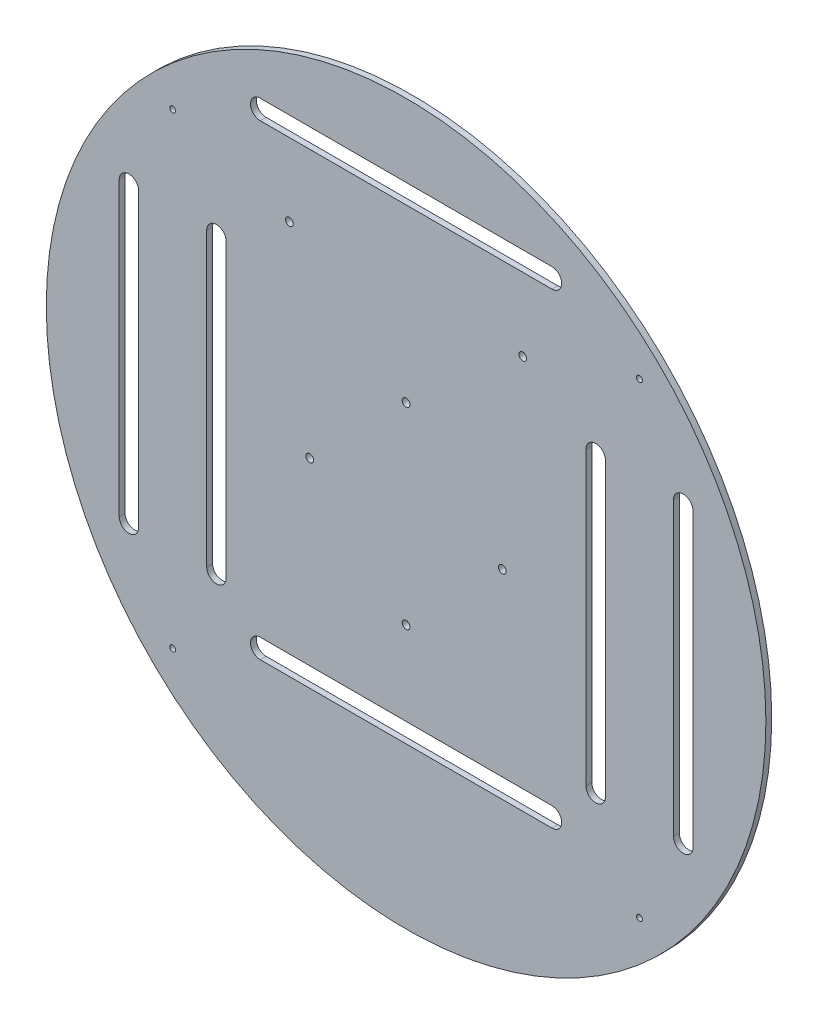
from build123d import *

# Parameters (mm, degrees)
SKETCH_1_R          = 185
SKETCH_1_R_2        = 1.5
EXTRUDE_1_DEPTH     = 3
SKETCH_2_R          = 2
CUT_EXTRUDE_1_DEPTH = 10


with BuildPart() as part:
    # 草图1 → 凸台-拉伸1 (new body)
    with BuildSketch(Plane.XY):
        Circle(SKETCH_1_R)
        with Locations((-120, 120)):
            Circle(SKETCH_1_R_2, mode=Mode.SUBTRACT)
        with Locations((120, 120)):
            Circle(SKETCH_1_R_2, mode=Mode.SUBTRACT)
        with Locations((120, -120)):
            Circle(SKETCH_1_R_2, mode=Mode.SUBTRACT)
        with Locations((-120, -120)):
            Circle(SKETCH_1_R_2, mode=Mode.SUBTRACT)
        with BuildLine():
            Line((-102.5, -75), (-102.5, 75))
            ThreePointArc((-102.5, 75), (-97.5, 80), (-92.5, 75))
            Line((-92.5, 75), (-92.5, -75))
            ThreePointArc((-92.5, -75), (-97.5, -80), (-102.5, -75))
        make_face(mode=Mode.SUBTRACT)
        with BuildLine():
            Line((147.5, -75), (147.5, 75))
            ThreePointArc((147.5, 75), (142.5, 80), (137.5, 75))
            Line((137.5, 75), (137.5, -75))
            ThreePointArc((137.5, -75), (142.5, -80), (147.5, -75))
        make_face(mode=Mode.SUBTRACT)
        with BuildLine():
            Line((-147.5, -75), (-147.5, 75))
            ThreePointArc((-147.5, 75), (-142.5, 80), (-137.5, 75))
            Line((-137.5, 75), (-137.5, -75))
            ThreePointArc((-137.5, -75), (-142.5, -80), (-147.5, -75))
        make_face(mode=Mode.SUBTRACT)
        with BuildLine():
            Line((-75, -102.5), (75, -102.5))
            ThreePointArc((75, -102.5), (80, -97.5), (75, -92.5))
            Line((75, -92.5), (-75, -92.5))
            ThreePointArc((-75, -92.5), (-80, -97.5), (-75, -102.5))
        make_face(mode=Mode.SUBTRACT)
        with BuildLine():
            Line((-75, 147.5), (75, 147.5))
            ThreePointArc((75, 147.5), (80, 142.5), (75, 137.5))
            Line((75, 137.5), (-75, 137.5))
            ThreePointArc((-75, 137.5), (-80, 142.5), (-75, 147.5))
        make_face(mode=Mode.SUBTRACT)
        with BuildLine():
            Line((102.5, -75), (102.5, 75))
            ThreePointArc((102.5, 75), (97.5, 80), (92.5, 75))
            Line((92.5, 75), (92.5, -75))
            ThreePointArc((92.5, -75), (97.5, -80), (102.5, -75))
        make_face(mode=Mode.SUBTRACT)
    extrude(amount=EXTRUDE_1_DEPTH)

    # 草图2 → 切除-拉伸1 (cut)
    with BuildSketch(Plane.XY.offset(3)):
        with Locations((0, 49.5)):
            Circle(SKETCH_2_R)
        with Locations((0, -49.5)):
            Circle(SKETCH_2_R)
        with Locations((49.5, 0)):
            Circle(SKETCH_2_R)
        with Locations((-49.5, 0)):
            Circle(SKETCH_2_R)
        with Locations((60, 100)):
            Circle(SKETCH_2_R)
        with Locations((-60, 100)):
            Circle(SKETCH_2_R)
    extrude(amount=-CUT_EXTRUDE_1_DEPTH, mode=Mode.SUBTRACT)


solid = part.part
